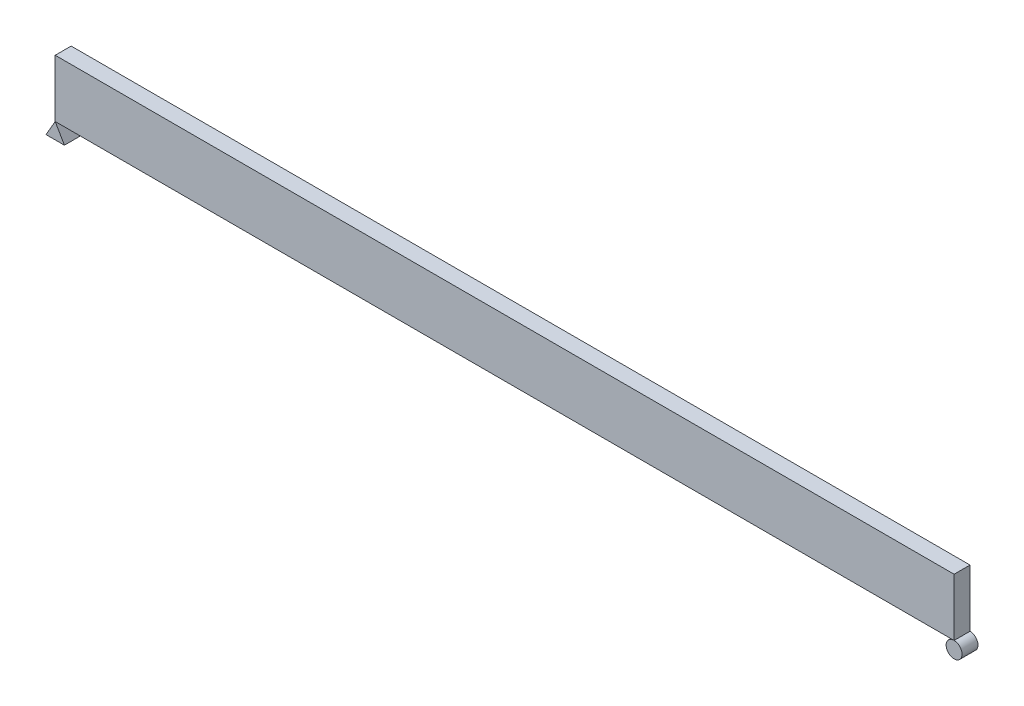
from build123d import *

# Parameters (mm, degrees)
SKETCH1_R             = 63.5
BOSS_EXTRUDE1_DEPTH   = 127
BOSS_EXTRUDE1_2_DEPTH = 127
SKETCH1_W             = 7162.8
SKETCH1_H             = 457.2
BOSS_EXTRUDE1_3_DEPTH = 127


with BuildPart() as part:
    # Sketch1 → Boss-Extrude1 (new body)
    with BuildSketch(Plane.XY):
        with Locations((3581.4, -292.1)):
            Circle(SKETCH1_R)
    extrude(amount=BOSS_EXTRUDE1_DEPTH)


with BuildPart() as body_2:
    # Sketch1 → Boss-Extrude1 2 (new body)
    with BuildSketch(Plane.XY):
        Polygon((-3508.076515813, -355.6), (-3581.4, -228.6), (-3654.723484187, -355.6), align=None)
    extrude(amount=BOSS_EXTRUDE1_2_DEPTH)


with BuildPart() as body_3:
    # Sketch1 → Boss-Extrude1 3 (new body)
    with BuildSketch(Plane.XY):
        Rectangle(SKETCH1_W, SKETCH1_H)
    extrude(amount=BOSS_EXTRUDE1_3_DEPTH)


solid = Compound([part.part, body_2.part, body_3.part])
